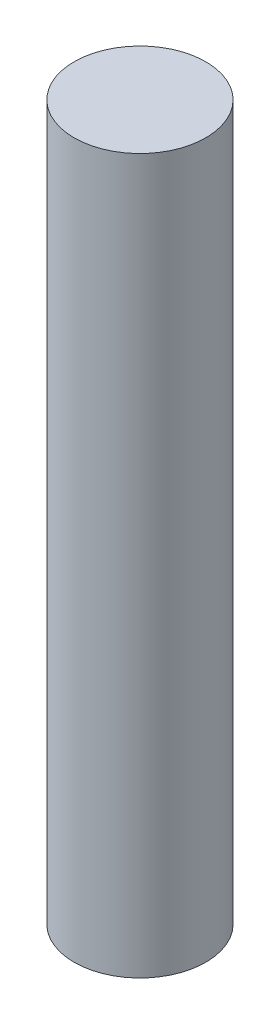
from build123d import *

# Parameters (mm, degrees)
SKTUBOTELESCOPIO_R   = 125
TUBOTELESCOPIO_DEPTH = 1355


with BuildPart() as part:
    # SkTuboTelescopio → TuboTelescopio (new body)
    with BuildSketch(Plane(origin=(0, 152.5, 0), x_dir=(1, 0, 0), z_dir=(0, 1, 0))):
        with Locations(Location((0, 0, 0), (0, 0, 270))):
            Circle(SKTUBOTELESCOPIO_R)
    extrude(amount=TUBOTELESCOPIO_DEPTH)


solid = part.part
